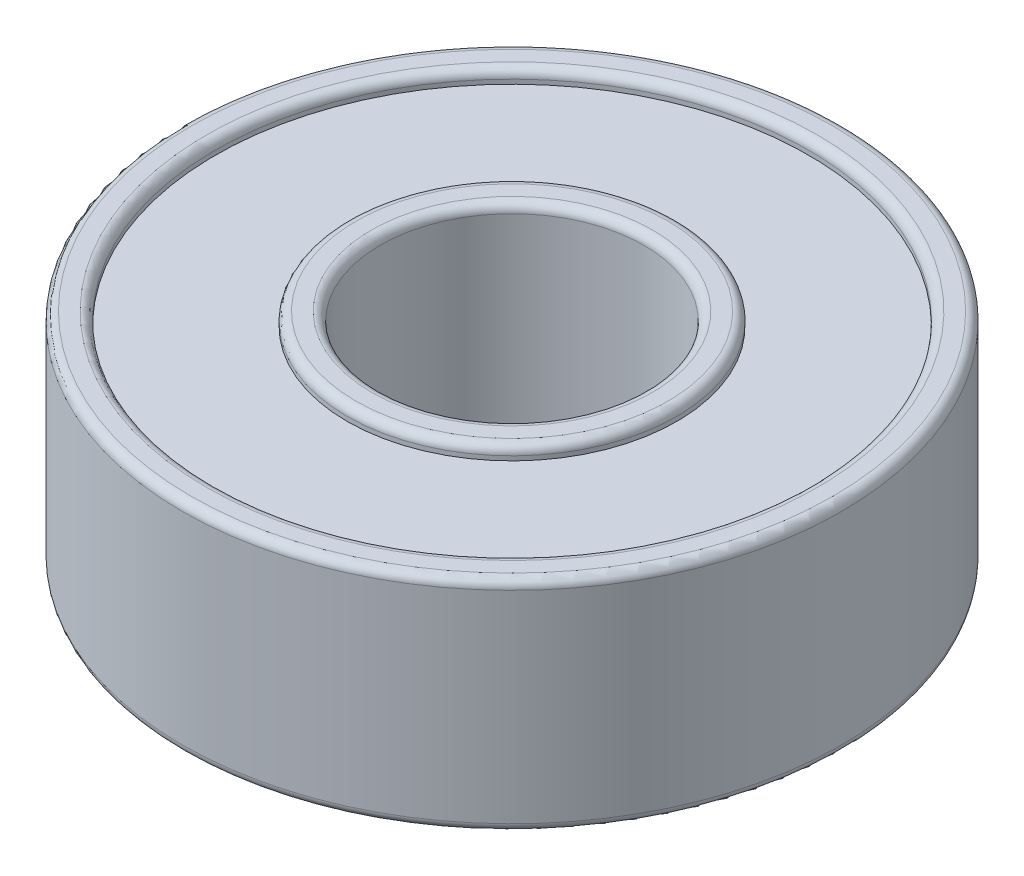
from build123d import *

# Parameters (mm, degrees)
SKETCH_1_R          = 7.5
SKETCH_1_R_2        = 3
EXTRUDE_1_DEPTH     = 2.5
SKETCH_2_R          = 6.75
SKETCH_2_R_2        = 3.75
CUT_EXTRUDE_1_DEPTH = 0.3
FILLET_1_R          = 0.2


with BuildPart() as part:
    # ｽｹｯﾁ1 → ﾎﾞｽ - 押し出し1 (new, symmetric)
    with BuildSketch(Plane(origin=(0, 0, 0), x_dir=(1, 0, 0), z_dir=(0, 1, 0))):
        with Locations(Location((0, 0, 0), (0, 0, 270))):
            Circle(SKETCH_1_R)
        with Locations(Location((0, 0, 0), (0, 0, 270))):
            Circle(SKETCH_1_R_2, mode=Mode.SUBTRACT)
    extrude(amount=EXTRUDE_1_DEPTH, both=True)

    # ｽｹｯﾁ2 → ｶｯﾄ - 押し出し1 (cut)
    with BuildSketch(Plane(origin=(0, 2.5, 0), x_dir=(1, 0, 0), z_dir=(0, 1, 0))):
        with Locations(Location((0, 0, 0), (0, 0, 270))):
            Circle(SKETCH_2_R)
        with Locations(Location((0, 0, 0), (0, 0, 270))):
            Circle(SKETCH_2_R_2, mode=Mode.SUBTRACT)
    cut_extrude_1 = extrude(amount=-CUT_EXTRUDE_1_DEPTH, mode=Mode.SUBTRACT)

    # ﾐﾗｰ1: ｶｯﾄ - 押し出し1 across plane
    add(cut_extrude_1.mirror(Plane.ZX), mode=Mode.SUBTRACT)

    # ﾌｨﾚｯﾄ1
    fillet_1_edges = [part.edges().sort_by_distance(p)[0] for p in [
        (0, 2.5, -3.75),
        (0, 2.5, -6.75),
        (0, -2.5, -6.75),
        (0, -2.5, -3.75),
        (0, -2.5, -7.5),
        (0, 2.5, -7.5),
        (0, -2.5, -3),
        (0, 2.5, -3),
    ]]
    fillet(fillet_1_edges, radius=FILLET_1_R)


solid = part.part
